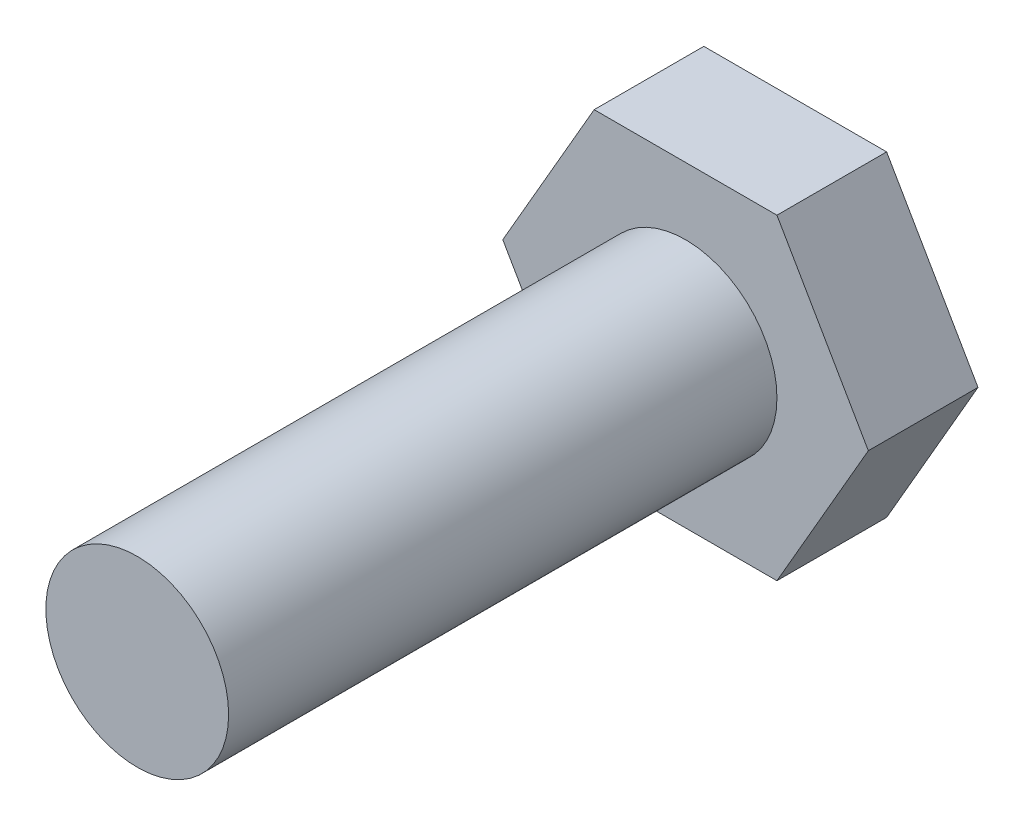
from build123d import *

# Parameters (mm, degrees)
EXTRUDE_1_DEPTH = 6
SKETCH_2_R      = 5
EXTRUDE_2_DEPTH = 30


with BuildPart() as part:
    # 草图1 → 凸台-拉伸1 (new body)
    with BuildSketch(Plane.XY):
        Polygon((10, 0), (5, 8.660254038), (-5, 8.660254038), (-10, 0), (-5, -8.660254038), (5, -8.660254038), align=None)
    extrude(amount=EXTRUDE_1_DEPTH)

    # 草图2 → 凸台-拉伸2 (add)
    with BuildSketch(Plane.XY.offset(6)):
        Circle(SKETCH_2_R)
    extrude(amount=EXTRUDE_2_DEPTH)


solid = part.part
